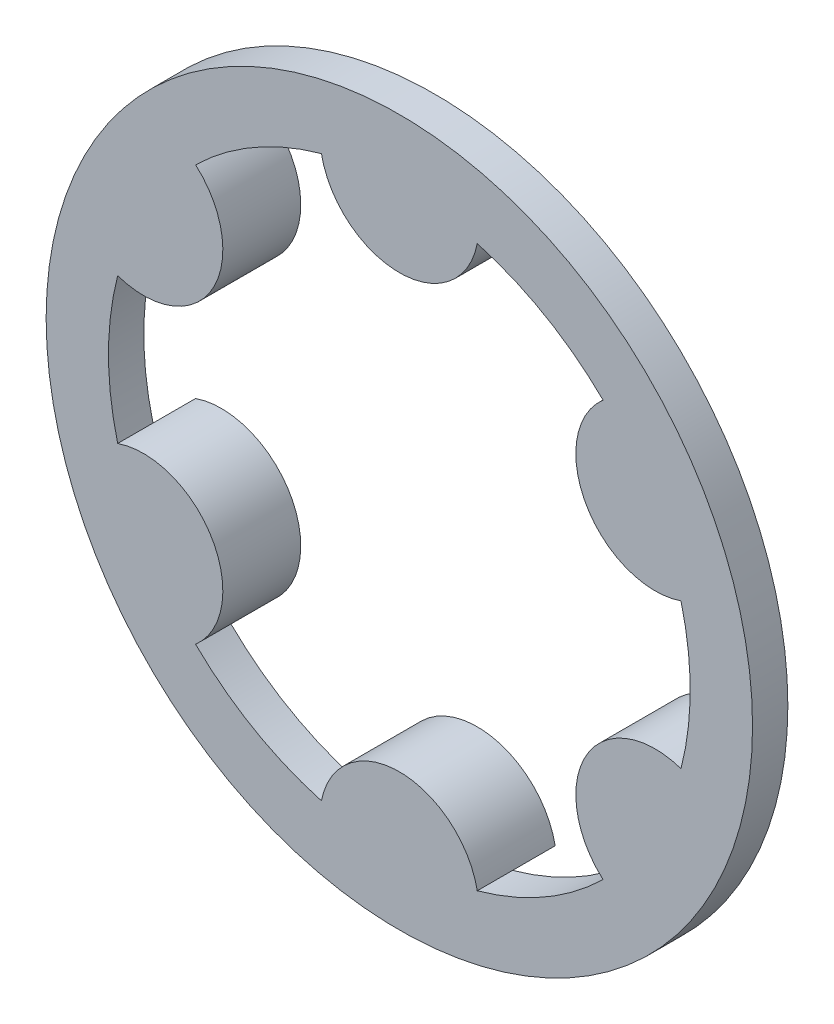
from build123d import *

# Parameters (mm, degrees)
SKETCH_1_R      = 34
SKETCH_1_R_2    = 28
EXTRUDE_1_DEPTH = 3.4
EXTRUDE_START   = -7.5
EXTRUDE_2_DEPTH = 7.5


with BuildPart() as part:
    # Эскиз1 → Бобышка-Вытянуть1 (new body)
    with BuildSketch(Plane.XY):
        Circle(SKETCH_1_R)
        Circle(SKETCH_1_R_2, mode=Mode.SUBTRACT)
    extrude(amount=EXTRUDE_1_DEPTH)

    # Эскиз2 → Бобышка-Вытянуть2 (add)
    with BuildSketch(Plane.XY.offset(3.4).offset(EXTRUDE_START)):
        with BuildLine():
            ThreePointArc((-7.5, 26.97684192), (0, 20.8), (7.5, 26.97684192))
            ThreePointArc((7.5, 26.97684192), (0, 28), (-7.5, 26.97684192))
        make_face()
        with BuildLine():
            ThreePointArc((19.612630417, 19.983611489), (18.013328399, 10.4), (27.112630417, 6.993230432))
            ThreePointArc((27.112630417, 6.993230432), (24.248711306, 14), (19.612630417, 19.983611489))
        make_face()
        with BuildLine():
            ThreePointArc((27.112630417, -6.993230432), (18.013328399, -10.4), (19.612630417, -19.983611489))
            ThreePointArc((19.612630417, -19.983611489), (24.248711306, -14), (27.112630417, -6.993230432))
        make_face()
        with BuildLine():
            ThreePointArc((7.5, -26.97684192), (0, -20.8), (-7.5, -26.97684192))
            ThreePointArc((-7.5, -26.97684192), (0, -28), (7.5, -26.97684192))
        make_face()
        with BuildLine():
            ThreePointArc((-19.612630417, -19.983611489), (-18.013328399, -10.4), (-27.112630417, -6.993230432))
            ThreePointArc((-27.112630417, -6.993230432), (-24.248711306, -14), (-19.612630417, -19.983611489))
        make_face()
        with BuildLine():
            ThreePointArc((-27.112630417, 6.993230432), (-18.013328399, 10.4), (-19.612630417, 19.983611489))
            ThreePointArc((-19.612630417, 19.983611489), (-24.248711306, 14), (-27.112630417, 6.993230432))
        make_face()
    extrude(amount=EXTRUDE_2_DEPTH)


solid = part.part
